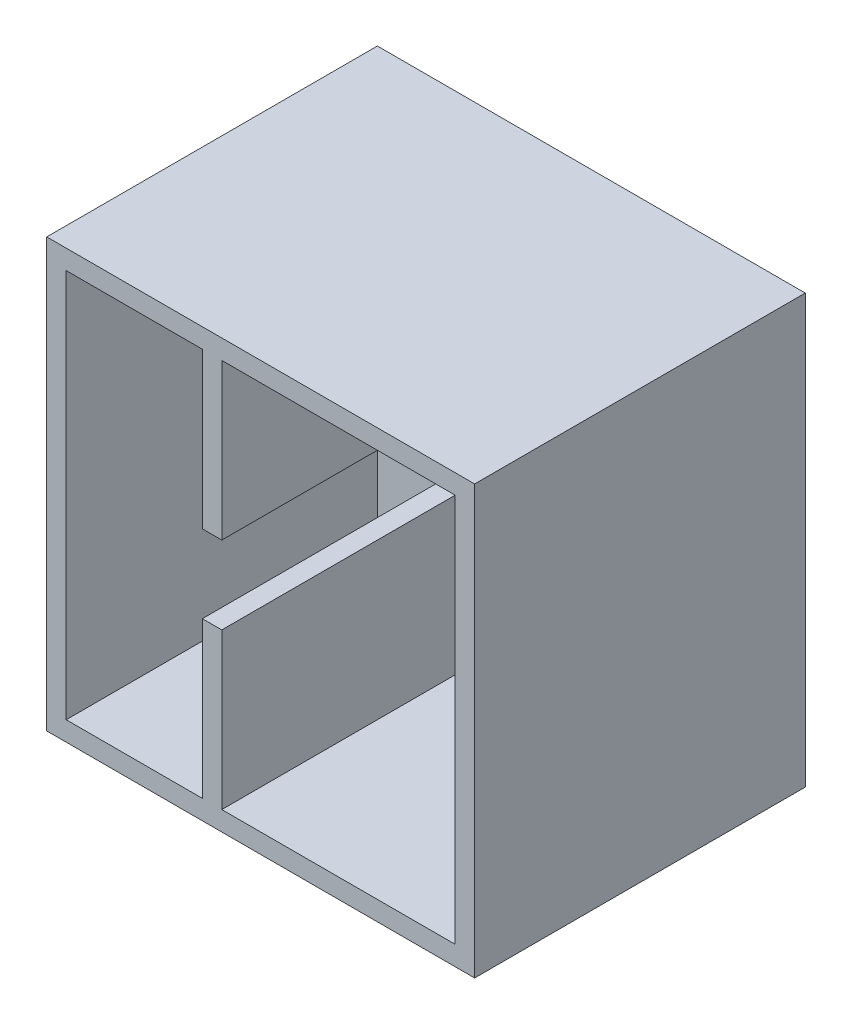
from build123d import *

# Parameters (mm, degrees)
SKETCH1_W           = 2200
SKETCH1_H           = 2200
BOSS_EXTRUDE1_DEPTH = 1700
SKETCH2_W           = 2200
SKETCH2_H           = 2200
BOSS_EXTRUDE2_DEPTH = 100


with BuildPart() as part:
    # Sketch1 → Boss-Extrude1 (new body)
    with BuildSketch(Plane.XY):
        Rectangle(SKETCH1_W, SKETCH1_H)
        Polygon((1000, -1000), (-200, -1000), (-200, -200), (-300, -200), (-300, -1000), (-1000, -1000), (-1000, 1000), (-300, 1000), (-300, 200), (-200, 200), (-200, 1000), (1000, 1000), align=None, mode=Mode.SUBTRACT)
    extrude(amount=BOSS_EXTRUDE1_DEPTH)

    # Sketch2 → Boss-Extrude2 (add)
    with BuildSketch(Plane(origin=(0, 0, 0), x_dir=(-1, 0, 0), z_dir=(0, 0, -1))):
        Rectangle(SKETCH2_W, SKETCH2_H)
    extrude(amount=-BOSS_EXTRUDE2_DEPTH)


solid = part.part
